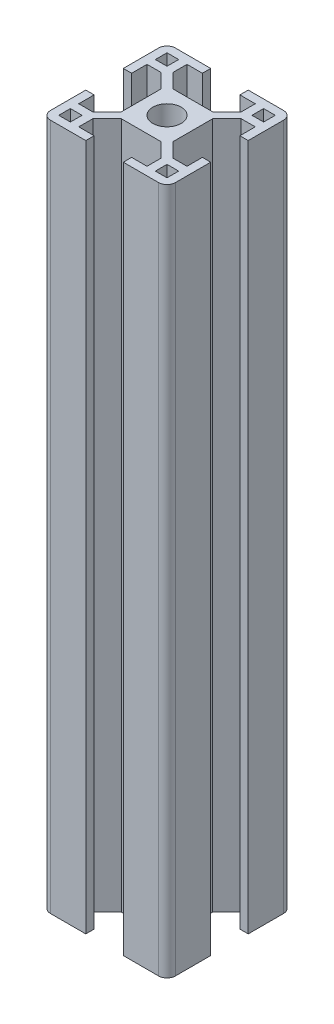
from build123d import *

# Parameters (mm, degrees)
SKETCH1_W           = 20
SKETCH1_H           = 20
EXTRUDE1_DEPTH      = 110
SKETCH2_R           = 2.266666667
SKETCH2_W           = 1.866666667
SKETCH2_H           = 1.866666667
EXTRUDE2_DEPTH      = 111.905365064
FILLET1_R           = 1.333333333
SKETCH_3_W          = 5
SKETCH_3_H          = 5
CUT_EXTRUDE_1_DEPTH = 10


with BuildPart() as part:
    # Sketch1 → Extrude1 (new body)
    with BuildSketch(Plane(origin=(0, 0, 0), x_dir=(1, 0, 0), z_dir=(0, 1, 0))):
        Rectangle(SKETCH1_W, SKETCH1_H)
    extrude(amount=EXTRUDE1_DEPTH)

    # Sketch2 → Extrude2 (cut, through all)
    with BuildSketch(Plane(origin=(0, 110, 0), x_dir=(1, 0, 0), z_dir=(0, 1, 0))):
        Circle(SKETCH2_R)
        Polygon((8.666666667, 3), (11.333333333, 3), (11.333333333, -3), (8.666666667, -3), (8.666666667, -5.466666667), (6.409475708, -5.466666667), (4.133333333, -3.190524292), (4.133333333, 3.190524292), (6.409475708, 5.466666667), (8.666666667, 5.466666667), align=None)
        with Locations((7.733333334, 7.733333334)):
            Rectangle(SKETCH2_W, SKETCH2_H)
        Polygon((-3.190524292, 4.133333333), (-5.466666667, 6.409475708), (-5.466666667, 8.666666667), (-3, 8.666666667), (-3, 11.333333333), (3, 11.333333333), (3, 8.666666667), (5.466666667, 8.666666667), (5.466666667, 6.409475708), (3.190524292, 4.133333333), align=None)
        with Locations((7.733333334, -7.733333334)):
            Rectangle(SKETCH2_W, SKETCH2_H)
        with Locations((-7.733333334, 7.733333334)):
            Rectangle(SKETCH2_W, SKETCH2_H)
        with Locations((-7.733333334, -7.733333334)):
            Rectangle(SKETCH2_W, SKETCH2_H)
        Polygon((-6.409475708, -5.466666667), (-8.666666667, -5.466666667), (-8.666666667, -3), (-11.333333333, -3), (-11.333333333, 3), (-8.666666667, 3), (-8.666666667, 5.466666667), (-6.409475708, 5.466666667), (-4.133333333, 3.190524292), (-4.133333333, -3.190524292), align=None)
        Polygon((3.190524292, -4.133333333), (-3.190524292, -4.133333333), (-5.466666667, -6.409475708), (-5.466666667, -8.666666667), (-3, -8.666666667), (-3, -11.333333333), (3, -11.333333333), (3, -8.666666667), (5.466666667, -8.666666667), (5.466666667, -6.409475708), align=None)
    extrude(amount=-EXTRUDE2_DEPTH, mode=Mode.SUBTRACT)

    # Fillet1
    fillet1_edges = [part.edges().sort_by_distance(p)[0] for p in [
        (10, 55, 10),
        (10, 55, -10),
        (-10, 55, 10),
        (-10, 55, -10),
    ]]
    fillet(fillet1_edges, radius=FILLET1_R)

    # Эскиз3 → Вырез-Вытянуть1 (cut, symmetric)
    with BuildSketch(Plane.XY):
        with Locations((0, 55)):
            Rectangle(SKETCH_3_W, SKETCH_3_H)
    extrude(amount=CUT_EXTRUDE_1_DEPTH, both=True, mode=Mode.SUBTRACT)


solid = part.part
